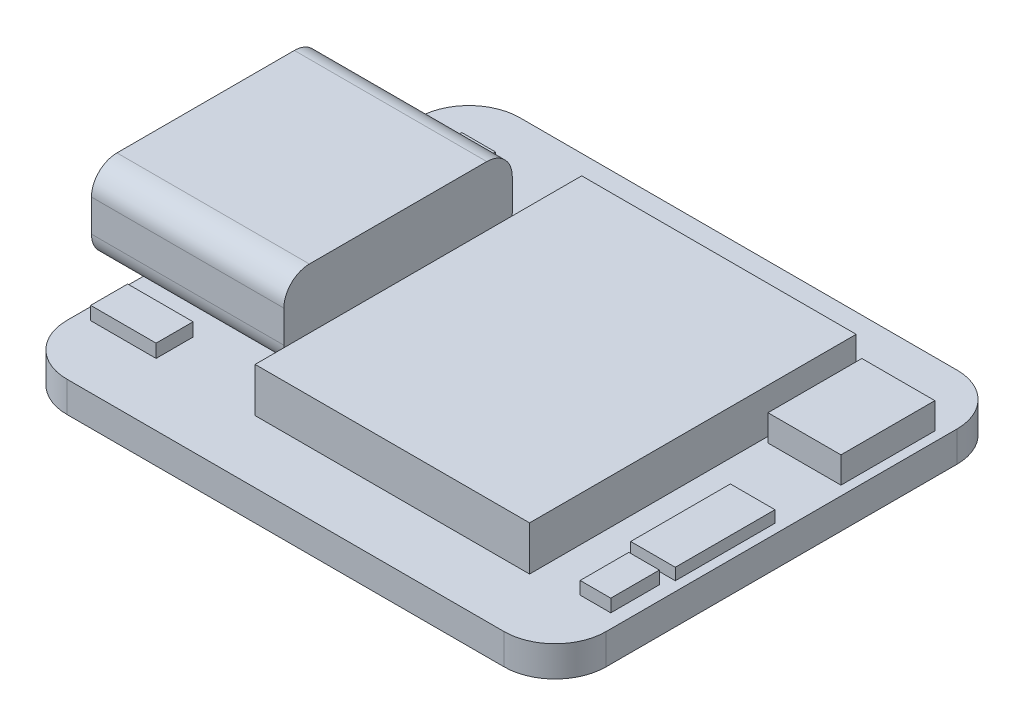
from build123d import *

# Parameters (mm, degrees)
SKETCH_1_W            = 1.320722759
SKETCH_1_H            = 1.348576416
EXTRUDE_2_DEPTH       = 2.06
SKETCH_1_3_W          = 2.567505851
SKETCH_1_3_H          = 1.451984885
EXTRUDE_3_DEPTH       = 1.72
SKETCH_1_4_W          = 10.768406503
SKETCH_1_4_H          = 12.814051925
EXTRUDE_4_DEPTH       = 2.94
SKETCH_1_5_W          = 1.751728556
SKETCH_1_5_H          = 3.911393899
EXTRUDE_5_DEPTH       = 1.66
SKETCH_1_6_W          = 2.863837954
SKETCH_1_6_H          = 3.684536573
EXTRUDE_6_DEPTH       = 2.23
SKETCH_1_7_W          = 0.666899611
SKETCH_1_7_H          = 1.198197092
EXTRUDE_7_DEPTH       = 1.64
SKETCH_1_8_W          = 1.201543901
SKETCH_1_8_H          = 1.909822412
EXTRUDE_8_DEPTH       = 1.7
EXTRUDE_9_DEPTH       = 1.2
EXTRUDE_10_DEPTH      = 1.45
EXTRUDE_10_DEPTH_BACK = 6.1


with BuildPart() as part:
    # 草图1 → 凸台-拉伸2 (new body)
    with BuildSketch(Plane(origin=(0, 0, 0), x_dir=(1, 0, 0), z_dir=(0, 1, 0))):
        with Locations((2.886090317, 14.593344496)):
            Rectangle(SKETCH_1_W, SKETCH_1_H)
    extrude(amount=EXTRUDE_2_DEPTH)



with BuildPart() as body_2:
    # 草图1<3> → 凸台-拉伸3 (new body)
    with BuildSketch(Plane(origin=(0, 0, 0), x_dir=(1, 0, 0), z_dir=(0, 1, 0))):
        with Locations((1.758272699, 3.179573222)):
            Rectangle(SKETCH_1_3_W, SKETCH_1_3_H)
    extrude(amount=EXTRUDE_3_DEPTH)


with BuildPart() as body_3:
    # 草图1<4> → 凸台-拉伸4 (new body)
    with BuildSketch(Plane(origin=(0, 0, 0), x_dir=(1, 0, 0), z_dir=(0, 1, 0))):
        with Locations((12.311476922, 8.860606741)):
            Rectangle(SKETCH_1_4_W, SKETCH_1_4_H)
    extrude(amount=EXTRUDE_4_DEPTH)


with BuildPart() as body_4:
    # 草图1<5> → 凸台-拉伸5 (new body)
    with BuildSketch(Plane(origin=(0, 0, 0), x_dir=(1, 0, 0), z_dir=(0, 1, 0))):
        with Locations((19.907360624, 7.039973628)):
            Rectangle(SKETCH_1_5_W, SKETCH_1_5_H)
    extrude(amount=EXTRUDE_5_DEPTH)


with BuildPart() as body_5:
    # 草图1<6> → 凸台-拉伸6 (new body)
    with BuildSketch(Plane(origin=(0, 0, 0), x_dir=(1, 0, 0), z_dir=(0, 1, 0))):
        with Locations((19.351305925, 13.425364418)):
            Rectangle(SKETCH_1_6_W, SKETCH_1_6_H)
    extrude(amount=EXTRUDE_6_DEPTH)


with BuildPart() as body_6:
    # 草图1<7> → 凸台-拉伸7 (new body)
    with BuildSketch(Plane(origin=(0, 0, 0), x_dir=(1, 0, 0), z_dir=(0, 1, 0))):
        with Locations((0.617323995, 14.668534158)):
            Rectangle(SKETCH_1_7_W, SKETCH_1_7_H)
    extrude(amount=EXTRUDE_7_DEPTH)


with BuildPart() as body_7:
    # 草图1<8> → 凸台-拉伸8 (new body)
    with BuildSketch(Plane(origin=(0, 0, 0), x_dir=(1, 0, 0), z_dir=(0, 1, 0))):
        with Locations((20.00563527, 3.683898)):
            Rectangle(SKETCH_1_8_W, SKETCH_1_8_H)
    extrude(amount=EXTRUDE_8_DEPTH)


with BuildPart() as part_1:
    add(part.part)

    add(body_2.part)  # 凸台-拉伸9 merges body 2

    add(body_3.part)  # 凸台-拉伸9 merges body 3

    add(body_4.part)  # 凸台-拉伸9 merges body 4

    add(body_5.part)  # 凸台-拉伸9 merges body 5

    add(body_6.part)  # 凸台-拉伸9 merges body 6

    add(body_7.part)  # 凸台-拉伸9 merges body 7
    # 草图1<9> → 凸台-拉伸9 (add)
    with BuildSketch(Plane(origin=(0, 0, 0), x_dir=(1, 0, 0), z_dir=(0, 1, 0))):
        with BuildLine():
            Line((2, 0), (19.15, 0))
            ThreePointArc((19.15, 0), (20.564213562, 0.585786438), (21.15, 2))
            Line((21.15, 2), (21.15, 15.77))
            ThreePointArc((21.15, 15.77), (20.564213562, 17.184213562), (19.15, 17.77))
            Line((19.15, 17.77), (2, 17.77))
            ThreePointArc((2, 17.77), (0.585786438, 17.184213562), (0, 15.77))
            Line((0, 15.77), (0, 2))
            ThreePointArc((0, 2), (0.585786438, 0.585786438), (2, 0))
        make_face()
    extrude(amount=EXTRUDE_9_DEPTH)

    # 草图4 → 凸台-拉伸10 (add, two sides: drawn at the far end of the back side and taken through both)
    with BuildSketch(Plane.ZY.offset(-EXTRUDE_10_DEPTH_BACK)):
        with BuildLine():
            Line((-12.37, 1.2), (-5.41, 1.2))
            ThreePointArc((-5.41, 1.2), (-4.702893219, 1.492893219), (-4.41, 2.2))
            Line((-4.41, 2.2), (-4.41, 3.46))
            ThreePointArc((-4.41, 3.46), (-4.702893219, 4.167106781), (-5.41, 4.46))
            Line((-5.41, 4.46), (-12.37, 4.46))
            ThreePointArc((-12.37, 4.46), (-13.077106781, 4.167106781), (-13.37, 3.46))
            Line((-13.37, 3.46), (-13.37, 2.2))
            ThreePointArc((-13.37, 2.2), (-13.077106781, 1.492893219), (-12.37, 1.2))
        make_face()
    extrude(amount=EXTRUDE_10_DEPTH + EXTRUDE_10_DEPTH_BACK)


solid = part_1.part
